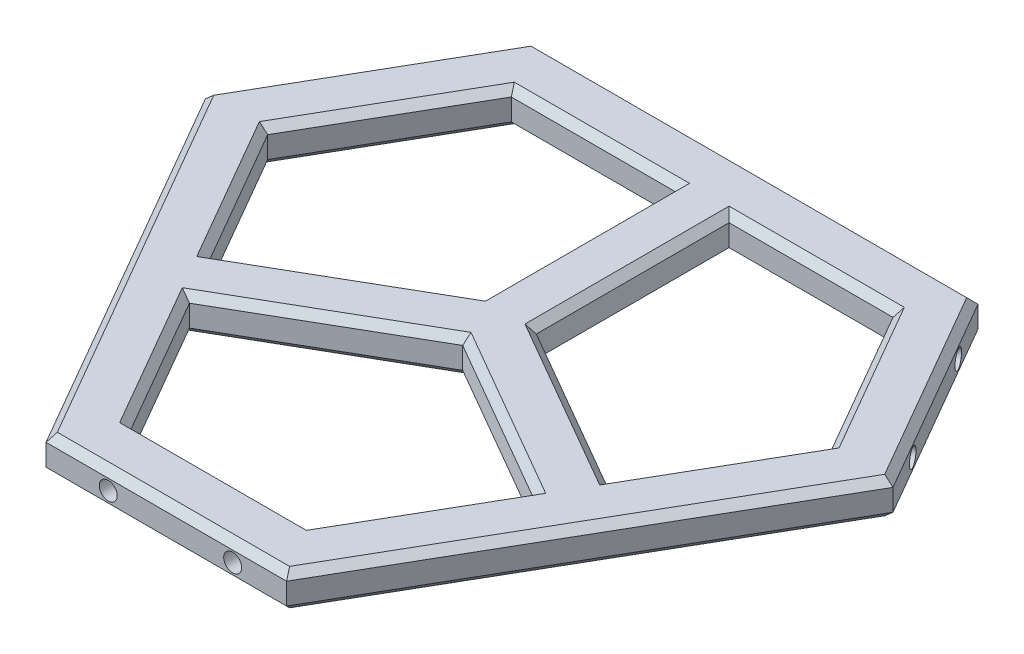
from build123d import *

# Parameters (mm, degrees)
BOSS_EXTRUDE1_DEPTH        = 5
BOSS_EXTRUDE1_DEPTH_BACK   = 5
M3X6X5_INSERT_HOLES1_D     = 5
M3X6X5_INSERT_HOLES1_DEPTH = 6.5
M3X6X5_INSERT_HOLES2_D     = 5
M3X6X5_INSERT_HOLES2_DEPTH = 6.5
M3X6X5_INSERT_HOLES3_D     = 5
M3X6X5_INSERT_HOLES3_DEPTH = 6.5
CUT_EXTRUDE3_DEPTH         = 132.434394281
CHAMFER3_SIZE              = 2


with BuildPart() as part:
    # Sketch1 → Boss-Extrude1 (new, two sides: drawn at the far end of the back side and taken through both)
    with BuildSketch(Plane(origin=(0, 0, 0), x_dir=(1, 0, 0), z_dir=(0, 1, 0)).offset(-BOSS_EXTRUDE1_DEPTH_BACK)):
        Polygon((-61.782032303, 72.990381057), (-95.262794416, 15), (-34.641016151, -90), (32.320508076, -90), (94.102540378, 17.009618943), (61.782032303, 72.990381057), align=None)
    extrude(amount=BOSS_EXTRUDE1_DEPTH + BOSS_EXTRUDE1_DEPTH_BACK)

    # M3x6x5 Insert Holes1
    with Locations(Plane.XY.offset(90)):
        with Locations((-17.320508076, 0), (17.320508076, 0)):
            Hole(M3X6X5_INSERT_HOLES1_D / 2, depth=M3X6X5_INSERT_HOLES1_DEPTH)

    # M3x6x5 Insert Holes2
    with Locations(Plane(origin=(77.942286341, 0, -45), x_dir=(-0.5000000000000001, 0, -0.8660254037844386), z_dir=(0.8660254037844386, 0, -0.5000000000000001))):
        with Locations((-17.320508076, 0), (17.320508076, 0)):
            Hole(M3X6X5_INSERT_HOLES2_D / 2, depth=M3X6X5_INSERT_HOLES2_DEPTH)

    # M3x6x5 Insert Holes3
    with Locations(Plane(origin=(-77.942286341, 0, -45), x_dir=(-0.5000000000000003, 0, 0.8660254037844386), z_dir=(-0.8660254037844386, 0, -0.5000000000000003))):
        with Locations((-17.320508076, 0), (17.320508076, 0)):
            Hole(M3X6X5_INSERT_HOLES3_D / 2, depth=M3X6X5_INSERT_HOLES3_DEPTH)

    # Sketch10 → Cut-Extrude3 (cut, through all)
    with BuildSketch(Plane(origin=(0, 5, 0), x_dir=(1, 0, 0), z_dir=(0, 1, 0))):
        Polygon((-7.5, 57.990381057), (-53.121778265, 57.990381057), (-77.942286341, 15), (-55.711524227, -23.504809472), (-7.5, 4.330127019), align=None)
        Polygon((7.5, 57.990381057), (53.121778265, 57.990381057), (76.782032303, 17.009618943), (53.97114317, -22.5), (7.5, 4.330127019), align=None)
        Polygon((46.47114317, -35.490381057), (23.660254038, -75), (-25.980762114, -75), (-48.211524227, -36.495190528), (0, -8.660254038), align=None)
    extrude(amount=-CUT_EXTRUDE3_DEPTH, mode=Mode.SUBTRACT)

    # Chamfer3
    chamfer3_edges = [part.edges().sort_by_distance(p)[0] for p in [
        (-78.52241336, -5, -43.995190528),
        (-64.951905284, -5, 37.5),
        (-1.160254038, -5, 90),
        (63.211524227, -5, 36.495190528),
        (77.942286341, -5, -45),
        (0, -5, -72.990381057),
        (64.951905284, -5, -37.5),
        (65.376587737, -5, 2.745190528),
        (30.735571585, -5, 9.084936491),
        (7.5, -5, -31.160254038),
        (30.310889132, -5, -57.990381057),
        (-7.5, -5, -31.160254038),
        (-31.605762114, -5, 9.587341226),
        (-66.826905284, -5, 4.252404736),
        (-65.532032303, -5, -36.495190528),
        (-30.310889132, -5, -57.990381057),
        (-1.160254038, -5, 75),
        (-37.09614317, -5, 55.747595264),
        (-24.105762114, -5, 22.577722283),
        (23.235571585, -5, 22.075317547),
        (35.065698604, -5, 55.245190528),
        (77.942286341, 5, -45),
        (63.211524227, 5, 36.495190528),
        (-1.160254038, 5, 90),
        (-64.951905284, 5, 37.5),
        (-78.52241336, 5, -43.995190528),
        (0, 5, -72.990381057),
        (30.735571585, 5, 9.084936491),
        (65.376587737, 5, 2.745190528),
        (64.951905284, 5, -37.5),
        (30.310889132, 5, -57.990381057),
        (7.5, 5, -31.160254038),
        (-66.826905284, 5, 4.252404736),
        (-31.605762114, 5, 9.587341226),
        (-7.5, 5, -31.160254038),
        (-30.310889132, 5, -57.990381057),
        (-65.532032303, 5, -36.495190528),
        (-24.105762114, 5, 22.577722283),
        (-37.09614317, 5, 55.747595264),
        (-1.160254038, 5, 75),
        (35.065698604, 5, 55.245190528),
        (23.235571585, 5, 22.075317547),
    ]]
    chamfer(chamfer3_edges, length=CHAMFER3_SIZE)


solid = part.part
